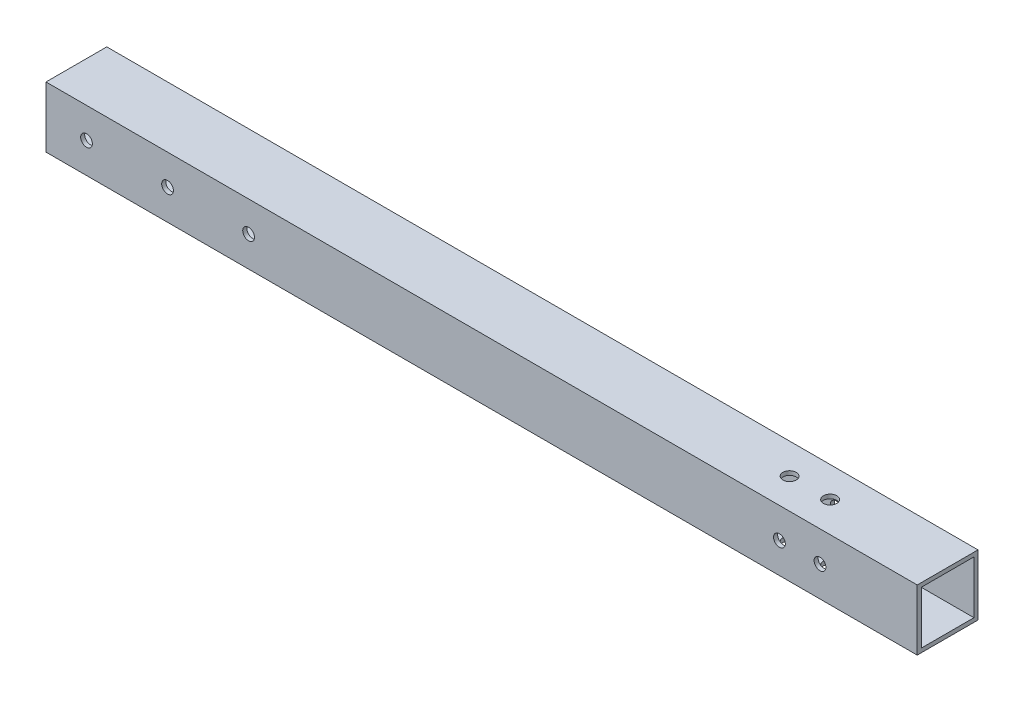
from build123d import *

# Parameters (mm, degrees)
SKETCH_1_W          = 15
SKETCH_1_H          = 15
SKETCH_1_W_2        = 13
SKETCH_1_H_2        = 13
EXTRUDE_1_DEPTH     = 215
SKETCH_2_R          = 1.45
CUT_EXTRUDE_1_DEPTH = 216.653077882
SKETCH_3_R          = 1.65
CUT_EXTRUDE_2_DEPTH = 216.653077882


with BuildPart() as part:
    # 草图1 → 凸台-拉伸1 (new body)
    with BuildSketch(Plane(origin=(0, 0, 0), x_dir=(0, 0, -1), z_dir=(1, 0, 0))):
        Rectangle(SKETCH_1_W, SKETCH_1_H)
        Rectangle(SKETCH_1_W_2, SKETCH_1_H_2, mode=Mode.SUBTRACT)
    extrude(amount=EXTRUDE_1_DEPTH)

    # 草图2 → 切除-拉伸1 (cut, through all)
    with BuildSketch(Plane.XY.offset(7.5)):
        with Locations((191, 0)):
            Circle(SKETCH_2_R)
        with Locations((181, 0)):
            Circle(SKETCH_2_R)
        with Locations((50, 0)):
            Circle(SKETCH_2_R)
        with Locations((30, 0)):
            Circle(SKETCH_2_R)
        with Locations((10, 0)):
            Circle(SKETCH_2_R)
    extrude(amount=-CUT_EXTRUDE_1_DEPTH, mode=Mode.SUBTRACT)

    # 草图3 → 切除-拉伸2 (cut, through all)
    with BuildSketch(Plane(origin=(0, 7.5, 0), x_dir=(1, 0, 0), z_dir=(0, 1, 0))):
        with Locations(Location((176, 0, 0), (0, 0, 270))):
            Circle(SKETCH_3_R)
        with Locations(Location((186, 0, 0), (0, 0, 270))):
            Circle(SKETCH_3_R)
    extrude(amount=-CUT_EXTRUDE_2_DEPTH, mode=Mode.SUBTRACT)


solid = part.part
